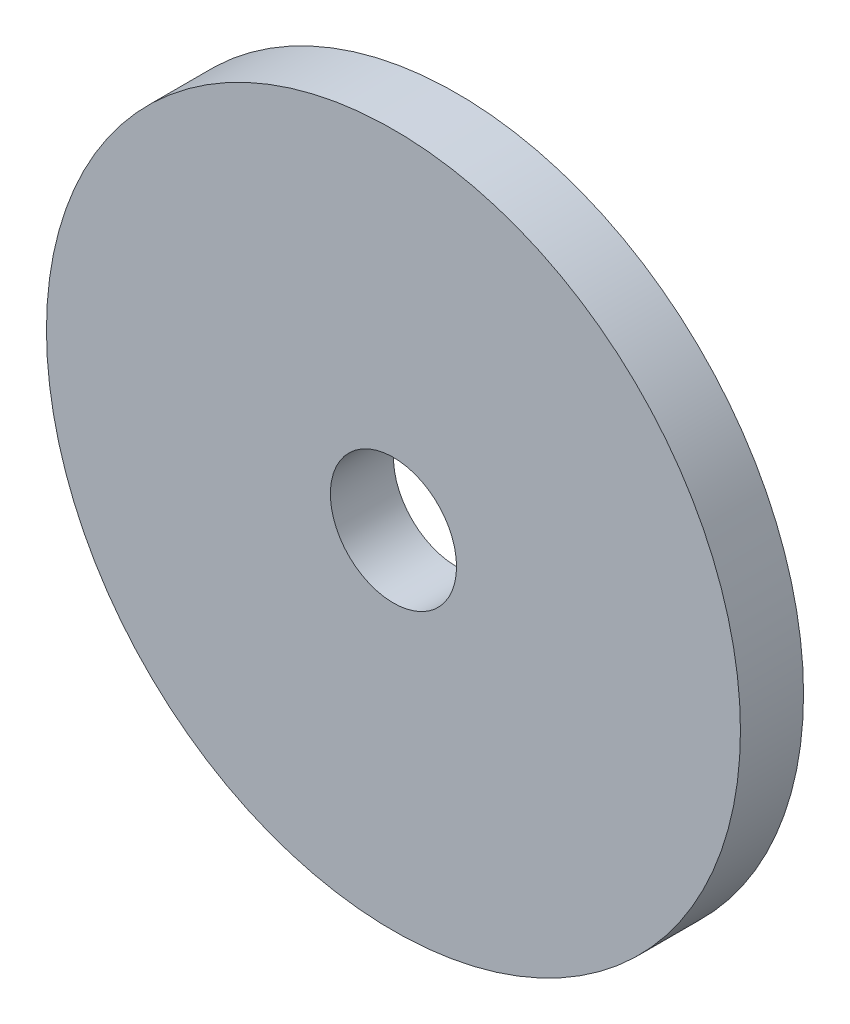
from build123d import *

# Parameters (mm, degrees)
SKETCH_1_R      = 11
SKETCH_1_R_2    = 2
EXTRUDE_1_DEPTH = 2


with BuildPart() as part:
    # 草图1 → 凸台-拉伸1 (new body)
    with BuildSketch(Plane.XY):
        Circle(SKETCH_1_R)
        Circle(SKETCH_1_R_2, mode=Mode.SUBTRACT)
    extrude(amount=EXTRUDE_1_DEPTH)


solid = part.part
